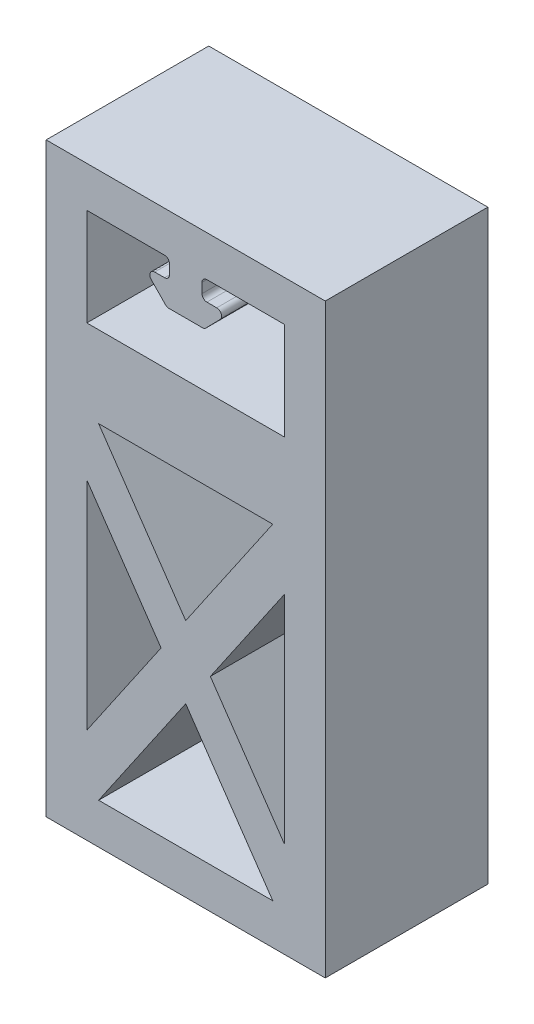
from build123d import *

# Parameters (mm, degrees)
BOSS_EXTRUDE1_DEPTH = 25.4
FILLET1_R           = 0.762


with BuildPart() as part:
    # Sketch1 → Boss-Extrude1 (new body)
    with BuildSketch(Plane.XY):
        Polygon((-21.799999961, -13.97), (-21.799999961, 13.97), (21.799999961, 13.97), (21.799999961, -13.97), (21.799999961, -77.619999954), (-21.799999961, -77.619999954), align=None)
        Polygon((-15.449999961, 7.62), (-2.54, 7.62), (-2.54, 4.572), (-6.6548, 4.572), (-2.933726616, 0.762), (2.933726616, 0.762), (6.6548, 4.572), (2.54, 4.572), (2.54, 7.62), (15.449999961, 7.62), (15.449999961, -7.62), (-15.449999961, -7.62), align=None, mode=Mode.SUBTRACT)
        Polygon((-13.601813914, -20.32), (0, -40.176776526), (13.601813914, -20.32), align=None, mode=Mode.SUBTRACT)
        Polygon((15.449999961, -28.858349607), (3.848460993, -45.794999977), (15.449999961, -62.731650347), align=None, mode=Mode.SUBTRACT)
        Polygon((-3.848460993, -45.794999977), (-15.449999961, -62.731650347), (-15.449999961, -28.858349607), align=None, mode=Mode.SUBTRACT)
        Polygon((0, -51.413223428), (-13.601813914, -71.269999954), (13.601813914, -71.269999954), align=None, mode=Mode.SUBTRACT)
    extrude(amount=BOSS_EXTRUDE1_DEPTH)

    # Fillet1
    fillet1_edges = [part.edges().sort_by_distance(p)[0] for p in [
        (2.54, 7.62, 12.7),
        (2.54, 4.572, 12.7),
        (6.6548, 4.572, 12.7),
        (2.933726616, 0.762, 12.7),
        (-2.933726616, 0.762, 12.7),
        (-6.6548, 4.572, 12.7),
        (-2.54, 4.572, 12.7),
        (-2.54, 7.62, 12.7),
    ]]
    fillet(fillet1_edges, radius=FILLET1_R)


solid = part.part
